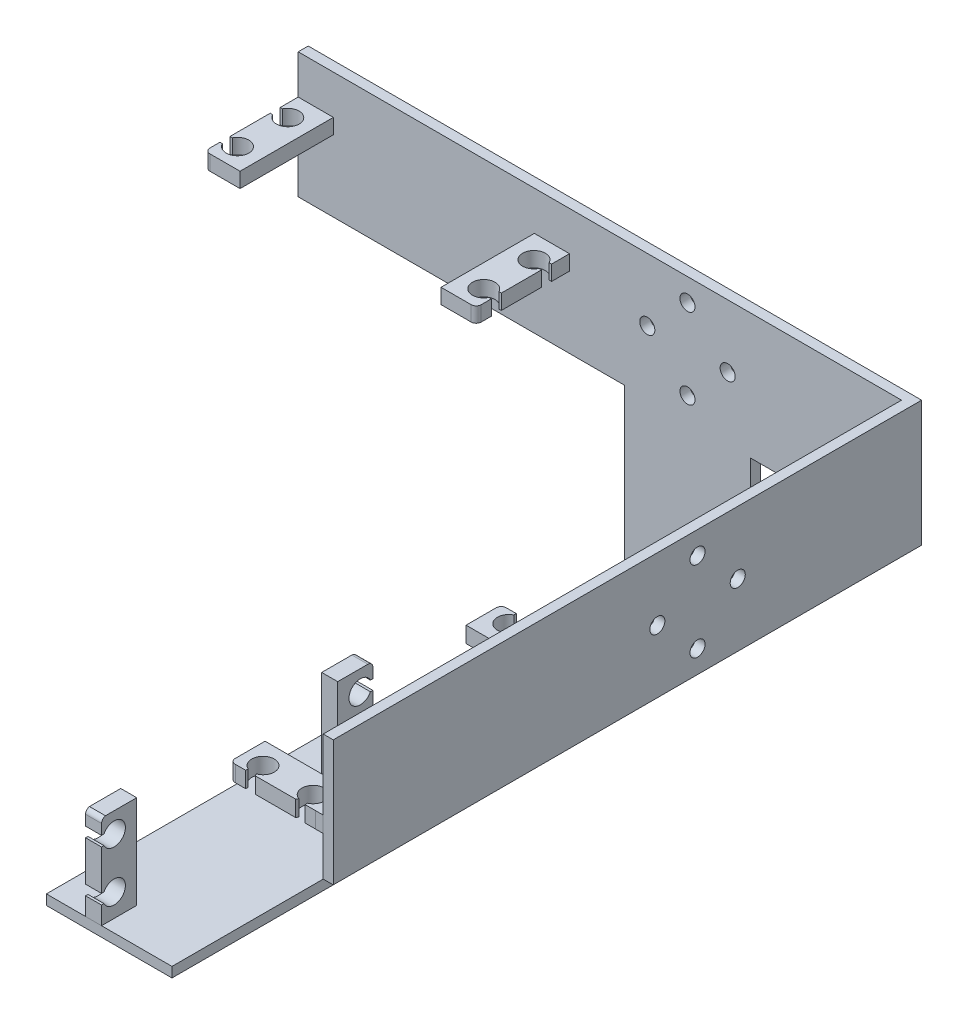
from build123d import *

# Parameters (mm, degrees)
BOSS_EXTRUDE1_DEPTH   = 25
SKETCH2_R             = 1.5
CUT_EXTRUDE1_DEPTH    = 11.313708668
SKETCH3_R             = 1.5
CUT_EXTRUDE2_DEPTH    = 25
BOSS_EXTRUDE2_DEPTH   = 32.1
SKETCH6_W             = 25
SKETCH6_H             = 30.1
CUT_EXTRUDE3_DEPTH    = 100.1
SKETCH10_R            = 1.5
CUT_EXTRUDE4_DEPTH    = 3
SKETCH11_W            = 15
SKETCH11_H            = 25
BOSS_EXTRUDE3_DEPTH   = 2
SKETCH12_W            = 25
SKETCH12_H            = 15
BOSS_EXTRUDE4_DEPTH   = 2
SKETCH14_W            = 19.982358932
SKETCH14_H            = 25
BOSS_EXTRUDE5_DEPTH   = 2
BOSS_EXTRUDE6_DEPTH   = 10.98
CUT_EXTRUDE5_DEPTH    = 7.8
SKETCH19_W            = 1.638684298
SKETCH19_H            = 6.943435059
BOSS_EXTRUDE7_DEPTH   = 3.18
BOSS_EXTRUDE8_DEPTH   = 10.98
SKETCH22_W            = 19.026159865
SKETCH22_H            = 7
CUT_EXTRUDE6_DEPTH    = 7.8
SKETCH25_W            = 7
SKETCH25_H            = 18.57
BOSS_EXTRUDE9_DEPTH   = 10.98
BOSS_EXTRUDE9_2_DEPTH = 10.98
CUT_EXTRUDE9_DEPTH    = 10.98
CUT_EXTRUDE10_DEPTH   = 7.8
CUT_EXTRUDE11_DEPTH   = 146.586836536
SKETCH30_W            = 7
SKETCH30_H            = 18.57
CUT_EXTRUDE12_DEPTH   = 7.8
SKETCH31_W            = 7
SKETCH31_H            = 18.57
BOSS_EXTRUDE10_DEPTH  = 10.8
CUT_EXTRUDE13_DEPTH   = 166.52108627
SKETCH33_W            = 7
SKETCH33_H            = 18.57
CUT_EXTRUDE14_DEPTH   = 7.8
CUT_EXTRUDE15_DEPTH   = 11.02


with BuildPart() as part:
    # Sketch1 → Boss-Extrude1 (new body)
    with BuildSketch(Plane(origin=(0, 0, 0), x_dir=(1, 0, 0), z_dir=(0, 1, 0))):
        Polygon((0, 0), (102.1, 0), (102.1, -102.1), (100.1, -102.1), (100.1, -2), (0, -2), align=None)
    extrude(amount=-BOSS_EXTRUDE1_DEPTH)

    # Sketch2 → Cut-Extrude1 (cut)
    with BuildSketch(Plane(origin=(0, 0, 0), x_dir=(-1, 0, 0), z_dir=(0, 0, -1))):
        with Locations((-65.500000119, -12.5)):
            Circle(SKETCH2_R)
        with Locations((-57.5, -20.500000119)):
            Circle(SKETCH2_R)
        with Locations((-49.499999881, -12.5)):
            Circle(SKETCH2_R)
        with Locations((-57.5, -4.499999881)):
            Circle(SKETCH2_R)
    extrude(amount=-CUT_EXTRUDE1_DEPTH, mode=Mode.SUBTRACT)

    # Sketch3 → Cut-Extrude2 (cut)
    with BuildSketch(Plane(origin=(102.1, 0, 0), x_dir=(0, 0, -1), z_dir=(1, 0, 0))):
        with Locations((-44.6, -4.499999881)):
            Circle(SKETCH3_R)
        with Locations((-36.599999881, -12.5)):
            Circle(SKETCH3_R)
        with Locations((-52.600000119, -12.5)):
            Circle(SKETCH3_R)
        with Locations((-44.6, -20.500000119)):
            Circle(SKETCH3_R)
    extrude(amount=-CUT_EXTRUDE2_DEPTH, mode=Mode.SUBTRACT)

    # Sketch4 → Boss-Extrude2 (add)
    with BuildSketch(Plane(origin=(0, -25, 0), x_dir=(-1, 0, 0), z_dir=(0, -1, 0))):
        Polygon((-70, -102.1), (-70, -2), (-70, 0), (-45, 0), (-45, -2), (-45, -102.1), align=None)
    extrude(amount=BOSS_EXTRUDE2_DEPTH)

    # Sketch6 → Cut-Extrude3 (cut)
    with BuildSketch(Plane.XY.offset(102.1)):
        with Locations((57.5, -40.05)):
            Rectangle(SKETCH6_W, SKETCH6_H)
    extrude(amount=-CUT_EXTRUDE3_DEPTH, mode=Mode.SUBTRACT)

    # Sketch10 → Cut-Extrude4 (cut)
    with BuildSketch(Plane(origin=(0, -55.1, 0), x_dir=(1, 0, 0), z_dir=(0, 1, 0))):
        with Locations(Location((49.499999881, -44.6, 0), (0, 0, 270))):
            Circle(SKETCH10_R)
        with Locations(Location((57.5, -52.600000119, 0), (0, 0, 270))):
            Circle(SKETCH10_R)
        with Locations(Location((65.500000119, -44.6, 0), (0, 0, 270))):
            Circle(SKETCH10_R)
        with Locations(Location((57.5, -36.599999881, 0), (0, 0, 270))):
            Circle(SKETCH10_R)
    extrude(amount=-CUT_EXTRUDE4_DEPTH, mode=Mode.SUBTRACT)

    # Sketch11 → Boss-Extrude3 (add)
    with BuildSketch(Plane(origin=(102.1, 0, 0), x_dir=(0, 0, -1), z_dir=(1, 0, 0))):
        with Locations((-109.6, -12.5)):
            Rectangle(SKETCH11_W, SKETCH11_H)
    extrude(amount=-BOSS_EXTRUDE3_DEPTH)

    # Sketch12 → Boss-Extrude4 (add)
    with BuildSketch(Plane(origin=(0, -55.1, 0), x_dir=(1, 0, 0), z_dir=(0, 1, 0))):
        with Locations((57.5, -109.6)):
            Rectangle(SKETCH12_W, SKETCH12_H)
    extrude(amount=-BOSS_EXTRUDE4_DEPTH)

    # Sketch14 → Boss-Extrude5 (add)
    with BuildSketch(Plane(origin=(0, 0, 0), x_dir=(-1, 0, 0), z_dir=(0, 0, -1))):
        with Locations((9.991179466, -12.5)):
            Rectangle(SKETCH14_W, SKETCH14_H)
    extrude(amount=-BOSS_EXTRUDE5_DEPTH)



with BuildPart() as body_2:
    # Sketch16 → Boss-Extrude6 (new body)
    with BuildSketch(Plane(origin=(0, -25, 0), x_dir=(-1, 0, 0), z_dir=(0, -1, 0))):
        with BuildLine():
            Line((-99.5, -110.1), (-99.5, -116.099172404))
            ThreePointArc((-99.5, -116.099172404), (-99.174184183, -116.784181749), (-98.461315702, -117.043435059))
            Line((-98.461315702, -117.043435059), (-96.461591568, -117.043435059))
            Line((-96.461591568, -117.043435059), (-96.450706518, -116.559121802))
            ThreePointArc((-96.450706518, -116.559121802), (-95.409806802, -112.264107551), (-94.786714977, -116.639307685))
            Line((-94.786714977, -116.639307685), (-94.519584147, -117.043435059))
            Line((-94.519584147, -117.043435059), (-86.520687608, -117.043435059))
            Line((-86.520687608, -117.043435059), (-86.307399951, -116.60847967))
            ThreePointArc((-86.307399951, -116.60847967), (-85.58496883, -112.251900878), (-84.610283551, -116.559066315))
            Line((-84.610283551, -116.559066315), (-84.618329359, -117.043435059))
            Line((-84.618329359, -117.043435059), (-82.618605224, -117.043435059))
            ThreePointArc((-82.618605224, -117.043435059), (-81.8713085, -116.80415556), (-81.526771386, -116.099172404))
            Line((-81.526771386, -116.099172404), (-81.526771386, -110.1))
            Line((-81.526771386, -110.1), (-99.5, -110.1))
        make_face()
    extrude(amount=-BOSS_EXTRUDE6_DEPTH)

    # Sketch18 → Cut-Extrude5 (cut)
    with BuildSketch(Plane.XZ.offset(25)):
        with BuildLine():
            Line((81.526771386, 110.1), (99.5, 110.1))
            Line((99.5, 110.1), (99.5, 116.099172404))
            ThreePointArc((99.5, 116.099172404), (99.174184183, 116.784181749), (98.461315702, 117.043435059))
            Line((98.461315702, 117.043435059), (96.461591568, 117.043435059))
            Line((96.461591568, 117.043435059), (96.450706518, 116.559121802))
            ThreePointArc((96.450706518, 116.559121802), (95.409806802, 112.264107551), (94.786714977, 116.639307685))
            Line((94.786714977, 116.639307685), (94.519584147, 117.043435059))
            Line((94.519584147, 117.043435059), (86.520687608, 117.043435059))
            Line((86.520687608, 117.043435059), (86.307399951, 116.60847967))
            ThreePointArc((86.307399951, 116.60847967), (85.58496883, 112.251900878), (84.610283551, 116.559066315))
            Line((84.610283551, 116.559066315), (84.618329359, 117.043435059))
            Line((84.618329359, 117.043435059), (82.618605224, 117.043435059))
            ThreePointArc((82.618605224, 117.043435059), (81.8713085, 116.80415556), (81.526771386, 116.099172404))
            Line((81.526771386, 116.099172404), (81.526771386, 110.1))
        make_face()
    extrude(amount=-CUT_EXTRUDE5_DEPTH, mode=Mode.SUBTRACT)


with BuildPart() as part_1:
    add(part.part)

    add(body_2.part)  # Boss-Extrude7 merges body 2
    # Sketch19 → Boss-Extrude7 (add)
    with BuildSketch(Plane(origin=(0, -14.02, 0), x_dir=(1, 0, 0), z_dir=(0, 1, 0))):
        with Locations((99.280657851, -113.57171753)):
            Rectangle(SKETCH19_W, SKETCH19_H)
    extrude(amount=-BOSS_EXTRUDE7_DEPTH)

    # Sketch20 → Boss-Extrude8 (add)
    with BuildSketch(Plane(origin=(0, -25, 0), x_dir=(-1, 0, 0), z_dir=(0, -1, 0))):
        with BuildLine():
            Line((-81.526771386, -70.1), (-81.526771386, -64.1))
            ThreePointArc((-81.526771386, -64.1), (-81.819664605, -63.392893219), (-82.526771386, -63.1))
            Line((-82.526771386, -63.1), (-84.526771386, -63.1))
            Line((-84.526771386, -63.1), (-84.526771386, -63.584435563))
            ThreePointArc((-84.526771386, -63.584435563), (-85.526771386, -67.85), (-86.526771386, -63.584435563))
            Line((-86.526771386, -63.584435563), (-86.526771386, -63.1))
            Line((-86.526771386, -63.1), (-94.526771386, -63.1))
            Line((-94.526771386, -63.1), (-94.526771386, -63.584435563))
            ThreePointArc((-94.526771386, -63.584435563), (-95.526771386, -67.85), (-96.526771386, -63.584435563))
            Line((-96.526771386, -63.584435563), (-96.526771386, -63.1))
            Line((-96.526771386, -63.1), (-100.1, -63.1))
            Line((-100.1, -63.1), (-100.1, -70.1))
            Line((-100.1, -70.1), (-81.526771386, -70.1))
        make_face()
    extrude(amount=-BOSS_EXTRUDE8_DEPTH)

    # Sketch22 → Cut-Extrude6 (cut)
    with BuildSketch(Plane.XZ.offset(25)):
        with Locations((90.586920068, 66.6)):
            Rectangle(SKETCH22_W, SKETCH22_H)
    extrude(amount=-CUT_EXTRUDE6_DEPTH, mode=Mode.SUBTRACT)

    # Sketch31 → Boss-Extrude10 (add)
    with BuildSketch(Plane(origin=(0, 0, 0), x_dir=(1, 0, 0), z_dir=(0, 1, 0))):
        with Locations((30.517641068, -11.285)):
            Rectangle(SKETCH31_W, SKETCH31_H)
        with Locations((-16.482358932, -11.285)):
            Rectangle(SKETCH31_W, SKETCH31_H)
    extrude(amount=-BOSS_EXTRUDE10_DEPTH)

    # Sketch32 → Cut-Extrude13 (cut, through all)
    with BuildSketch(Plane(origin=(0, 0, 0), x_dir=(1, 0, 0), z_dir=(0, 1, 0))):
        with BuildLine():
            Line((33.533205505, -17.57), (34.017641068, -17.57))
            Line((34.017641068, -17.57), (34.017641068, -15.57))
            Line((34.017641068, -15.57), (33.533205505, -15.57))
            ThreePointArc((33.533205505, -15.57), (29.267641068, -16.57), (33.533205505, -17.57))
        make_face()
        with BuildLine():
            Line((34.017641068, -7.57), (34.017641068, -5.57))
            Line((34.017641068, -5.57), (33.533205505, -5.57))
            ThreePointArc((33.533205505, -5.57), (29.267641068, -6.57), (33.533205505, -7.57))
            Line((33.533205505, -7.57), (34.017641068, -7.57))
        make_face()
        with BuildLine():
            ThreePointArc((34.017641068, -19.57), (33.724747849, -20.277106781), (33.017641068, -20.57))
            Line((33.017641068, -20.57), (34.017641068, -20.57))
            Line((34.017641068, -20.57), (34.017641068, -19.57))
        make_face()
    extrude(amount=-CUT_EXTRUDE13_DEPTH, mode=Mode.SUBTRACT)

    # Sketch33 → Cut-Extrude14 (cut)
    with BuildSketch(Plane(origin=(0, 0, 0), x_dir=(1, 0, 0), z_dir=(0, 1, 0))):
        with Locations((30.517641068, -11.285)):
            Rectangle(SKETCH33_W, SKETCH33_H)
        with Locations((-16.482358932, -11.285)):
            Rectangle(SKETCH33_W, SKETCH33_H)
    extrude(amount=-CUT_EXTRUDE14_DEPTH, mode=Mode.SUBTRACT)

    # Sketch34 → Cut-Extrude15 (cut)
    with BuildSketch(Plane(origin=(0, -7.8, 0), x_dir=(1, 0, 0), z_dir=(0, 1, 0))):
        with BuildLine():
            Line((-19.49792337, -5.57), (-19.982358932, -5.57))
            Line((-19.982358932, -5.57), (-19.982358932, -7.57))
            Line((-19.982358932, -7.57), (-19.49792337, -7.57))
            ThreePointArc((-19.49792337, -7.57), (-15.232358932, -6.57), (-19.49792337, -5.57))
        make_face()
        with BuildLine():
            Line((-19.49792337, -15.57), (-19.982358932, -15.57))
            Line((-19.982358932, -15.57), (-19.982358932, -17.57))
            Line((-19.982358932, -17.57), (-19.49792337, -17.57))
            ThreePointArc((-19.49792337, -17.57), (-15.232358932, -16.57), (-19.49792337, -15.57))
        make_face()
        with BuildLine():
            Line((-19.982358932, -20.57), (-18.982358932, -20.57))
            ThreePointArc((-18.982358932, -20.57), (-19.689465714, -20.277106781), (-19.982358932, -19.57))
            Line((-19.982358932, -19.57), (-19.982358932, -20.57))
        make_face()
    extrude(amount=-CUT_EXTRUDE15_DEPTH, mode=Mode.SUBTRACT)


with BuildPart() as body_2_2:
    # Sketch25 → Boss-Extrude9 (new body)
    with BuildSketch(Plane.ZY.offset(-45)):
        with Locations((113.6, -45.815)):
            Rectangle(SKETCH25_W, SKETCH25_H)
    extrude(amount=-BOSS_EXTRUDE9_DEPTH)

    # Sketch27 → Cut-Extrude9 (cut)
    with BuildSketch(Plane.ZY.offset(-45)):
        with BuildLine():
            Line((116.615564437, -51.53), (117.1, -51.53))
            Line((117.1, -51.53), (117.1, -49.53))
            Line((117.1, -49.53), (116.615564437, -49.53))
            ThreePointArc((116.615564437, -49.53), (112.35, -50.53), (116.615564437, -51.53))
        make_face()
        with BuildLine():
            Line((116.615564437, -41.53), (117.1, -41.53))
            Line((117.1, -41.53), (117.1, -39.53))
            Line((117.1, -39.53), (116.615564437, -39.53))
            ThreePointArc((116.615564437, -39.53), (112.35, -40.53), (116.615564437, -41.53))
        make_face()
        with BuildLine():
            Line((117.1, -36.53), (116.325203993, -36.53))
            ThreePointArc((116.325203993, -36.53), (116.874874883, -36.871870833), (117.1, -37.478774808))
            Line((117.1, -37.478774808), (117.1, -36.53))
        make_face()
    extrude(amount=-CUT_EXTRUDE9_DEPTH, mode=Mode.SUBTRACT)

    # Sketch28 → Cut-Extrude10 (cut)
    with BuildSketch(Plane.ZY.offset(-45)):
        Polygon((110.1, -36.53), (117.125963379, -36.53), (117.1, -55.1), (110.1, -55.1), align=None)
    extrude(amount=-CUT_EXTRUDE10_DEPTH, mode=Mode.SUBTRACT)


with BuildPart() as body_3:
    # Sketch25 → Boss-Extrude9 2 (new body)
    with BuildSketch(Plane.ZY.offset(-45)):
        with Locations((66.6, -45.815)):
            Rectangle(SKETCH25_W, SKETCH25_H)
    extrude(amount=-BOSS_EXTRUDE9_2_DEPTH)

    # Sketch29 → Cut-Extrude11 (cut, through all)
    with BuildSketch(Plane.ZY.offset(-45)):
        with BuildLine():
            Line((63.584435563, -39.53), (63.1, -39.53))
            Line((63.1, -39.53), (63.1, -41.53))
            Line((63.1, -41.53), (63.584435563, -41.53))
            ThreePointArc((63.584435563, -41.53), (67.85, -40.53), (63.584435563, -39.53))
        make_face()
        with BuildLine():
            Line((63.1, -49.53), (63.1, -51.53))
            Line((63.1, -51.53), (63.584435563, -51.53))
            ThreePointArc((63.584435563, -51.53), (67.85, -50.53), (63.584435563, -49.53))
            Line((63.584435563, -49.53), (63.1, -49.53))
        make_face()
        with BuildLine():
            ThreePointArc((63.1, -37.53), (63.392893219, -36.822893219), (64.1, -36.53))
            Line((64.1, -36.53), (63.1, -36.53))
            Line((63.1, -36.53), (63.1, -37.53))
        make_face()
    extrude(amount=-CUT_EXTRUDE11_DEPTH, mode=Mode.SUBTRACT)

    # Sketch30 → Cut-Extrude12 (cut)
    with BuildSketch(Plane.ZY.offset(-45)):
        with Locations((66.6, -45.815)):
            Rectangle(SKETCH30_W, SKETCH30_H)
    extrude(amount=-CUT_EXTRUDE12_DEPTH, mode=Mode.SUBTRACT)


solid = Compound([part_1.part, body_2_2.part, body_3.part])
